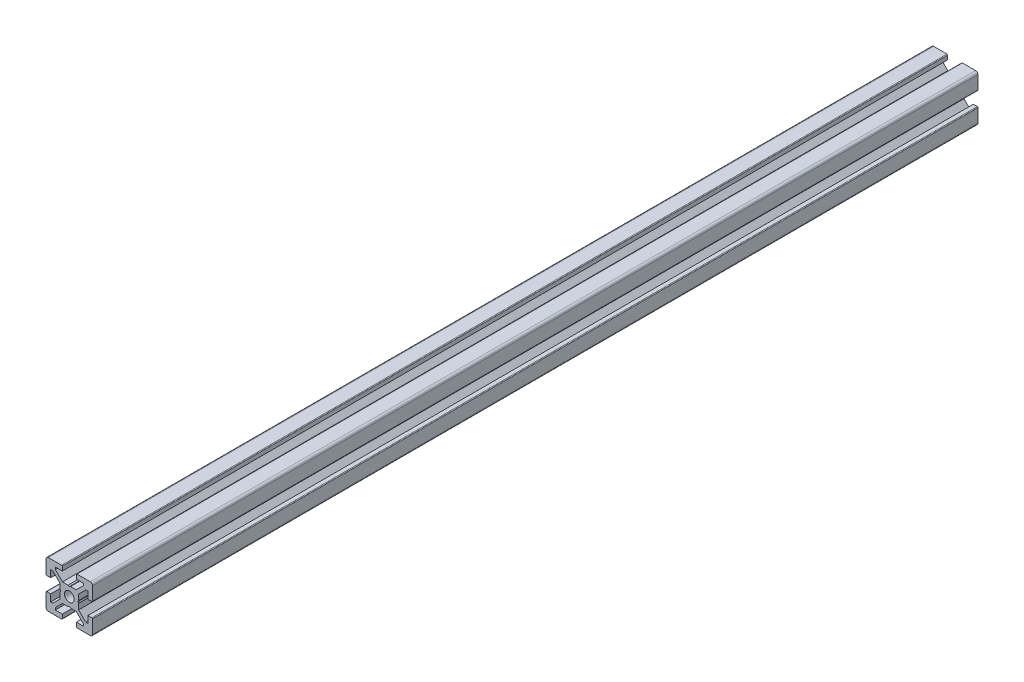
from build123d import *

# Parameters (mm, degrees)
BOSS_EXTRUDE1_DEPTH = 380
SKETCH2_W           = 400
SKETCH2_H           = 2.1


with BuildPart() as part:
    # Sketch1 → Boss-Extrude1 (new body)
    with BuildSketch(Plane.XY):
        with BuildLine():
            Line((-10, 9), (-10, 3.29999995))
            ThreePointArc((-10, 3.29999995), (-9.912132049, 3.087867916), (-9.7, 3))
            Line((-9.7, 3), (-8, 3))
            Line((-8, 3), (-8, 6))
            Line((-8, 6), (-7.060677, 6))
            Line((-7.060677, 6), (-4, 2.93932965))
            Line((-4, 2.93932965), (-4, 0.519615242))
            Line((-4, 0.519615242), (-3.699996283, -6.437e-06))
            Line((-3.699996283, -6.437e-06), (-4, -0.519628117))
            Line((-4, -0.519628117), (-4, -2.93933725))
            Line((-4, -2.93933725), (-7.0606695, -6))
            Line((-7.0606695, -6), (-8, -6))
            Line((-8, -6), (-8, -3))
            Line((-8, -3), (-9.7, -3))
            ThreePointArc((-9.7, -3), (-9.912132049, -3.087867916), (-10, -3.29999995))
            Line((-10, -3.29999995), (-10, -9))
            ThreePointArc((-10, -9), (-9.707106781, -9.707106781), (-9, -10))
            Line((-9, -10), (-3.29999995, -10))
            ThreePointArc((-3.29999995, -10), (-3.087867916, -9.912132049), (-3, -9.7))
            Line((-3, -9.7), (-3, -8))
            Line((-3, -8), (-6, -8))
            Line((-6, -8), (-6, -7.0606515))
            Line((-6, -7.0606515), (-2.9393489, -4))
            Line((-2.9393489, -4), (-0.519615242, -4))
            Line((-0.519615242, -4), (6.437e-06, -3.699996283))
            Line((6.437e-06, -3.699996283), (0.519628117, -4))
            Line((0.519628117, -4), (2.9393227, -4))
            Line((2.9393227, -4), (6, -7.060677))
            Line((6, -7.060677), (6, -8))
            Line((6, -8), (3, -8))
            Line((3, -8), (3, -9.7))
            ThreePointArc((3, -9.7), (3.087867916, -9.912132049), (3.29999995, -10))
            Line((3.29999995, -10), (9, -10))
            ThreePointArc((9, -10), (9.707106781, -9.707106781), (10, -9))
            Line((10, -9), (10, -3.29999995))
            ThreePointArc((10, -3.29999995), (9.912132049, -3.087867916), (9.7, -3))
            Line((9.7, -3), (8, -3))
            Line((8, -3), (8, -6))
            Line((8, -6), (7.0606435, -6))
            Line((7.0606435, -6), (4, -2.9393482))
            Line((4, -2.9393482), (4, -0.519615242))
            Line((4, -0.519615242), (3.699996283, 6.437e-06))
            Line((3.699996283, 6.437e-06), (4, 0.519628117))
            Line((4, 0.519628117), (4, 2.9393401))
            Line((4, 2.9393401), (7.060651, 6))
            Line((7.060651, 6), (8, 6))
            Line((8, 6), (8, 3))
            Line((8, 3), (9.7, 3))
            ThreePointArc((9.7, 3), (9.912132049, 3.087867916), (10, 3.29999995))
            Line((10, 3.29999995), (10, 9))
            ThreePointArc((10, 9), (9.707106781, 9.707106781), (9, 10))
            Line((9, 10), (3.29999995, 10))
            ThreePointArc((3.29999995, 10), (3.087867916, 9.912132049), (3, 9.7))
            Line((3, 9.7), (3, 8))
            Line((3, 8), (6, 8))
            Line((6, 8), (6, 7.060669))
            Line((6, 7.060669), (2.9393308, 4))
            Line((2.9393308, 4), (0.519615242, 4))
            Line((0.519615242, 4), (-6.437e-06, 3.699996283))
            Line((-6.437e-06, 3.699996283), (-0.519628117, 4))
            Line((-0.519628117, 4), (-2.93935655, 4))
            Line((-2.93935655, 4), (-6, 7.0606435))
            Line((-6, 7.0606435), (-6, 8))
            Line((-6, 8), (-3, 8))
            Line((-3, 8), (-3, 9.7))
            ThreePointArc((-3, 9.7), (-3.087867966, 9.912132034), (-3.3, 10))
            Line((-3.3, 10), (-9, 10))
            ThreePointArc((-9, 10), (-9.707106781, 9.707106781), (-10, 9))
        make_face()
    extrude(amount=-BOSS_EXTRUDE1_DEPTH)

    # Sketch2 → Cut-Revolve1 (revolve, cut)
    with BuildSketch(Plane(origin=(0, 0, 0), x_dir=(0, 0, -1), z_dir=(1, 0, 0)), mode=Mode.PRIVATE) as cut_revolve1_sk:
        with Locations((200, 1.05)):
            Rectangle(SKETCH2_W, SKETCH2_H)
    revolve(cut_revolve1_sk.sketch.rotate(Axis((0, 0, -400), (0, 0, 1)), 270), axis=Axis((0, 0, -400), (0, 0, 1)), mode=Mode.SUBTRACT)


solid = part.part
